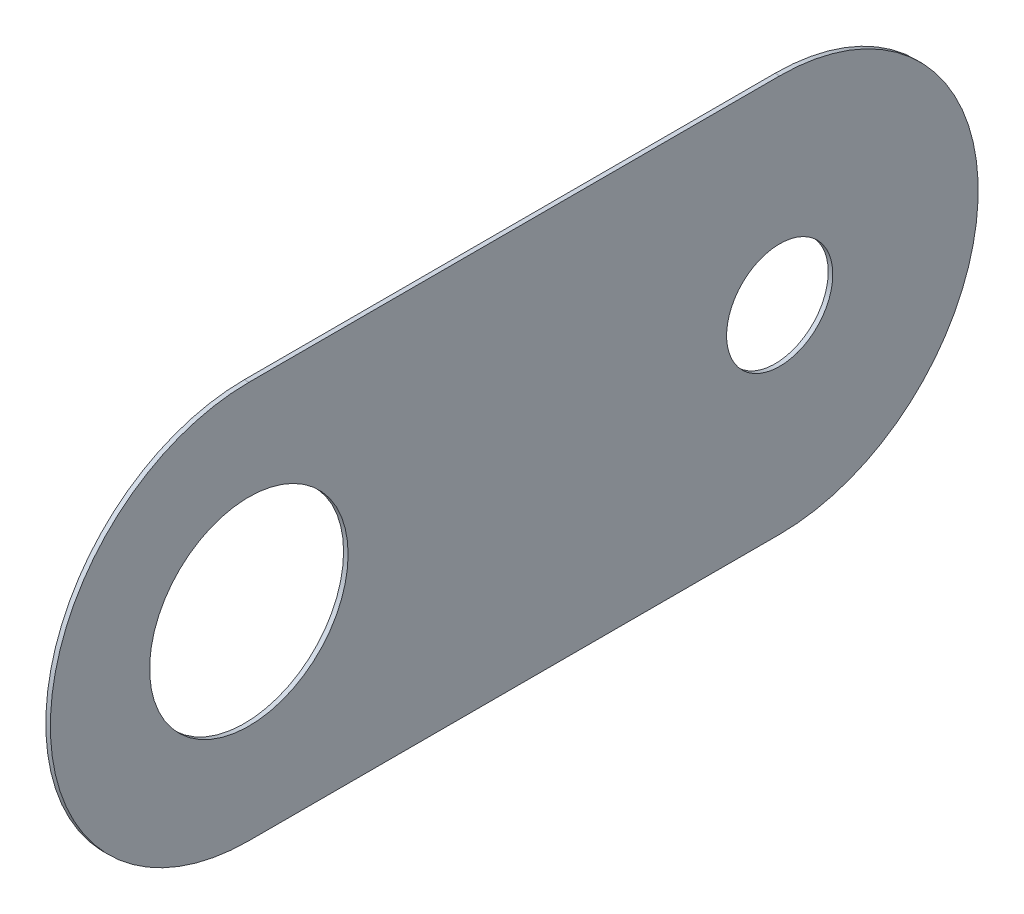
from build123d import *

# Parameters (mm, degrees)
SKETCH1_R           = 12.7
SKETCH1_R_2         = 23.749
BOSS_EXTRUDE2_DEPTH = 1.08712


with BuildPart() as part:
    # Sketch1 → Boss-Extrude2 (new body)
    with BuildSketch(Plane.YZ):
        with BuildLine():
            Line((0, 0), (0, 127))
            ThreePointArc((0, 127), (47.498, 174.498), (94.996, 127))
            Line((94.996, 127), (94.996, 0))
            ThreePointArc((94.996, 0), (47.498, -47.498), (0, 0))
        make_face()
        with Locations(Location((47.498, 0, 0), (0, 0, 270))):
            Circle(SKETCH1_R, mode=Mode.SUBTRACT)
        with Locations(Location((47.498, 127, 0), (0, 0, 270))):
            Circle(SKETCH1_R_2, mode=Mode.SUBTRACT)
    extrude(amount=BOSS_EXTRUDE2_DEPTH)


solid = part.part
